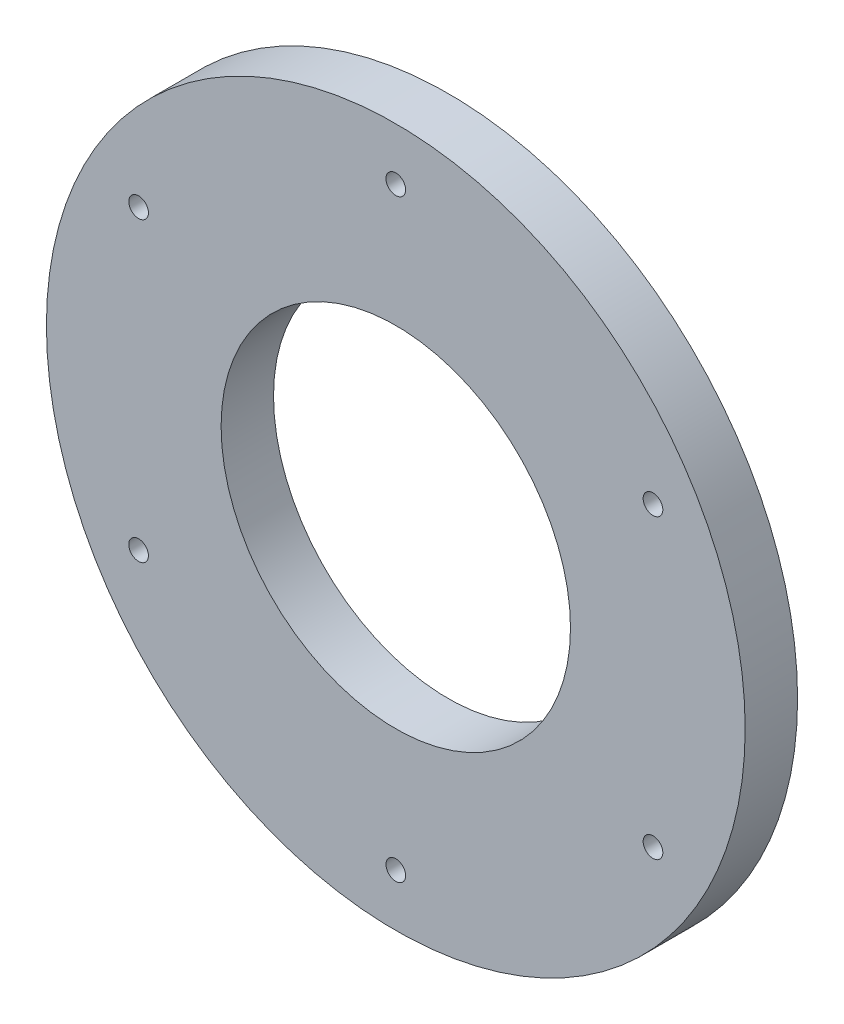
from build123d import *

# Parameters (mm, degrees)
SKETCH1_R               = 127
BOSS_EXTRUDE1_DEPTH     = 19.05
F_1_4_CLEARANCE_HOLE1_D = 7.14248
CUT_EXTRUDE1_REACH      = 182.613
SKETCH4_R               = 63.5


with BuildPart() as part:
    # Sketch1 → Boss-Extrude1 (new body)
    with BuildSketch(Plane.XY):
        with Locations(Location((0, 0, 0), (0, 0, 180))):
            Circle(SKETCH1_R)
    extrude(amount=BOSS_EXTRUDE1_DEPTH)

    # 1/4 Clearance Hole1 (through all)
    with Locations(Plane.XY.offset(19.05)):
        with Locations((-93.487442339, 53.975), (0, 107.95), (93.487442339, 53.975), (93.487442339, -53.975), (0, -107.95), (-93.487442339, -53.975)):
            Hole(F_1_4_CLEARANCE_HOLE1_D / 2)

    # Sketch4 → Cut-Extrude1 (cut, up to next)
    with BuildSketch(Plane.XY.offset(19.05), mode=Mode.PRIVATE) as cut_extrude1_sk1:
        Circle(SKETCH4_R)
    cut_extrude1_tool1 = extrude(cut_extrude1_sk1.sketch, amount=-CUT_EXTRUDE1_REACH, mode=Mode.PRIVATE) & part.part
    add(cut_extrude1_tool1.solids().sort_by_distance((0, 0, 19.05))[0], mode=Mode.SUBTRACT)


solid = part.part
